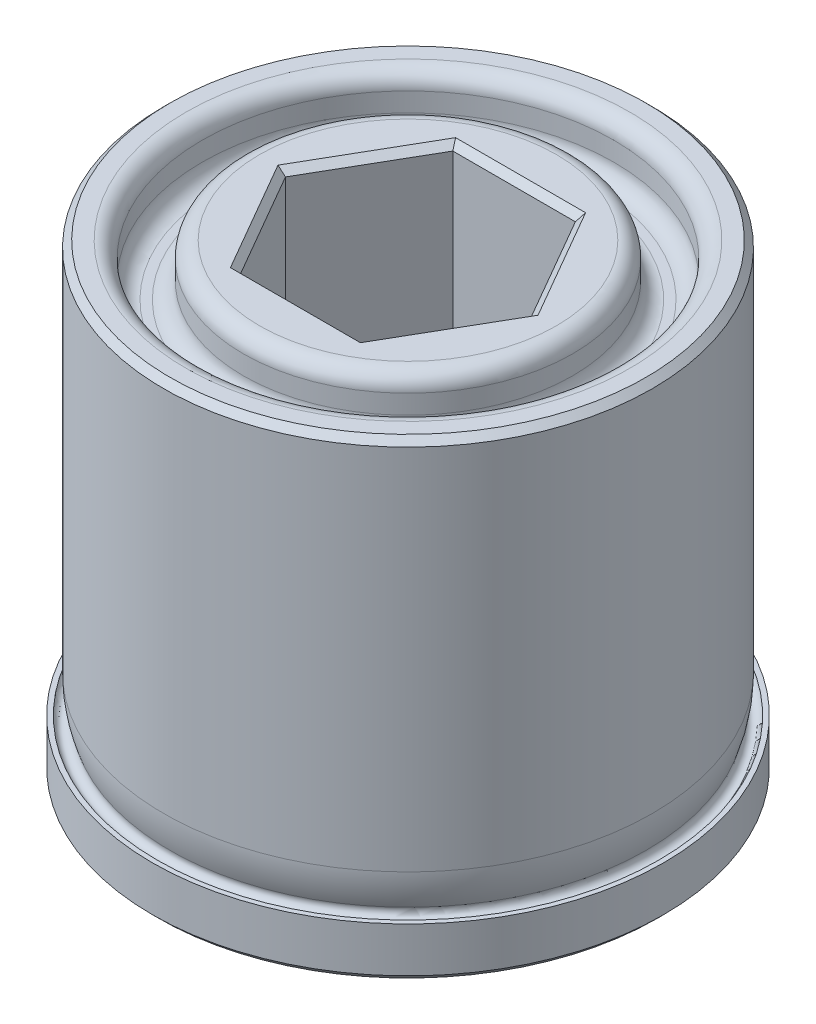
from build123d import *

# Parameters (mm, degrees)
CHAMFER1_SIZE      = 0.4
CUT_EXTRUDE1_DEPTH = 38.1
CHAMFER2_SIZE      = 0.4
CHAMFER3_SIZE      = 0.4
SKETCH6_R          = 12.7
SKETCH6_R_2        = 10.16
CUT_EXTRUDE2_DEPTH = 3.175
FILLET2_R          = 1
FILLET7_R          = 6.35


with BuildPart() as part:
    # Sketch4 → Revolve1 (revolve)
    with BuildSketch(Plane.XY):
        with BuildLine():
            Line((0, 0), (0, 25.4))
            Line((0, 25.4), (15.081250054, 25.4))
            Line((15.081250054, 25.4), (15.081250054, 0.4))
            ThreePointArc((15.081250054, 0.4), (14.798407342, -0.282842712), (15.481250054, 0))
            Line((15.481250054, 0), (15.775, 0))
            Line((15.775, 0), (15.775, -3.175))
            Line((15.775, -3.175), (0, -3.175))
            Line((0, -3.175), (0, 0))
        make_face()
    revolve(axis=Axis((0, 0, 0), (0, 1, 0)))

    # Chamfer1
    chamfer1_edges = [part.edges().sort_by_distance(p)[0] for p in [
        (-15.081250054, 25.4, 0),
    ]]
    chamfer(chamfer1_edges, length=CHAMFER1_SIZE)

    # Sketch5 → Cut-Extrude1 (cut)
    with BuildSketch(Plane(origin=(0, 25.4, 0), x_dir=(1, 0, 0), z_dir=(0, 1, 0))):
        Polygon((7.563288526, 0), (3.781644263, 6.55), (-3.781644263, 6.55), (-7.563288526, 0), (-3.781644263, -6.55), (3.781644263, -6.55), align=None)
    extrude(amount=-CUT_EXTRUDE1_DEPTH, mode=Mode.SUBTRACT)

    # Chamfer2
    chamfer2_edges = [part.edges().sort_by_distance(p)[0] for p in [
        (5.672466395, -3.175, 3.275),
        (0, -3.175, 6.55),
        (-5.672466395, -3.175, 3.275),
        (-5.672466395, -3.175, -3.275),
        (0, -3.175, -6.55),
        (5.672466395, -3.175, -3.275),
        (5.672466395, 25.4, 3.275),
        (5.672466395, 25.4, -3.275),
        (0, 25.4, -6.55),
        (-5.672466395, 25.4, -3.275),
        (-5.672466395, 25.4, 3.275),
        (0, 25.4, 6.55),
    ]]
    chamfer(chamfer2_edges, length=CHAMFER2_SIZE)

    # Chamfer3
    chamfer3_edges = [part.edges().sort_by_distance(p)[0] for p in [
        (-15.775, -3.175, 0),
    ]]
    chamfer(chamfer3_edges, length=CHAMFER3_SIZE)

    # Sketch6 → Cut-Extrude2 (cut)
    with BuildSketch(Plane(origin=(0, 25.4, 0), x_dir=(1, 0, 0), z_dir=(0, 1, 0))):
        with Locations(Location((0, 0, 0), (0, 0, 180))):
            Circle(SKETCH6_R)
        with Locations(Location((0, 0, 0), (0, 0, 180))):
            Circle(SKETCH6_R_2, mode=Mode.SUBTRACT)
    extrude(amount=-CUT_EXTRUDE2_DEPTH, mode=Mode.SUBTRACT)

    # Fillet2
    fillet2_edges = [part.edges().sort_by_distance(p)[0] for p in [
        (12.7, 22.225, 0),
        (10.16, 22.225, 0),
        (12.7, 25.4, 0),
        (10.16, 25.4, 0),
    ]]
    fillet(fillet2_edges, radius=FILLET2_R)

    # Fillet7
    fillet7_edges = [part.edges().sort_by_distance(p)[0] for p in [
        (-15.081250054, 0.4, 0),
    ]]
    fillet(fillet7_edges, radius=FILLET7_R)


solid = part.part
